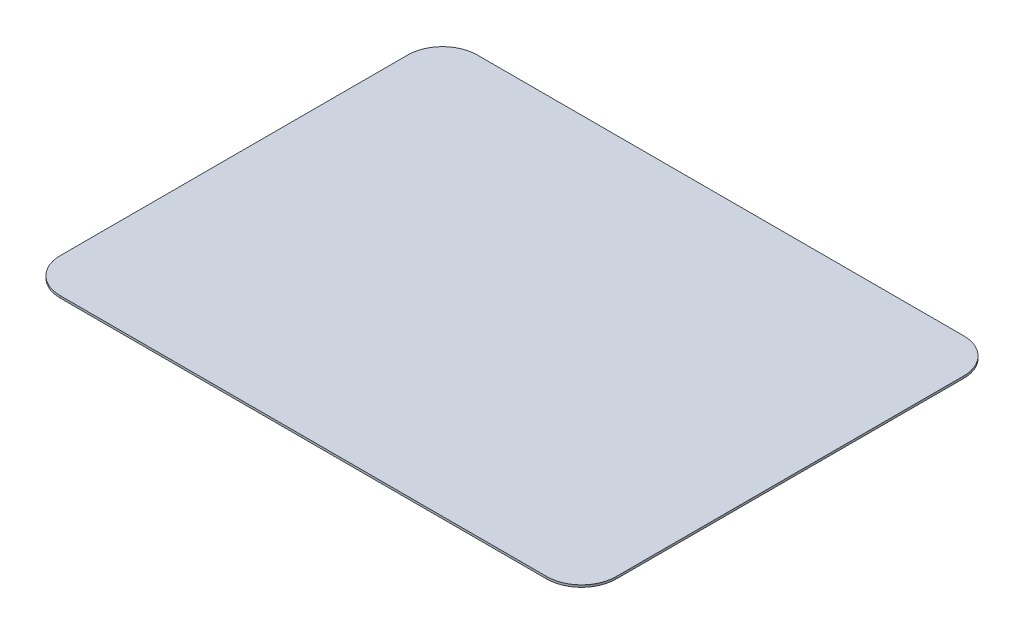
from build123d import *

# Parameters (mm, degrees)
MAINBODY_DEPTH = 0.79375


with BuildPart() as part:
    # Sketch1 → MainBody (new body)
    with BuildSketch(Plane(origin=(0, 6.35, 0), x_dir=(1, 0, 0), z_dir=(0, 1, 0))):
        with BuildLine():
            Line((101.6, -63.5), (101.6, 63.5))
            ThreePointArc((101.6, 63.5), (97.880256121, 72.480256121), (88.9, 76.2))
            Line((88.9, 76.2), (-88.9, 76.2))
            ThreePointArc((-88.9, 76.2), (-97.880256121, 72.480256121), (-101.6, 63.5))
            Line((-101.6, 63.5), (-101.6, -63.5))
            ThreePointArc((-101.6, -63.5), (-97.880256121, -72.480256121), (-88.9, -76.2))
            Line((-88.9, -76.2), (88.9, -76.2))
            ThreePointArc((88.9, -76.2), (97.880256121, -72.480256121), (101.6, -63.5))
        make_face()
    extrude(amount=MAINBODY_DEPTH)


solid = part.part
